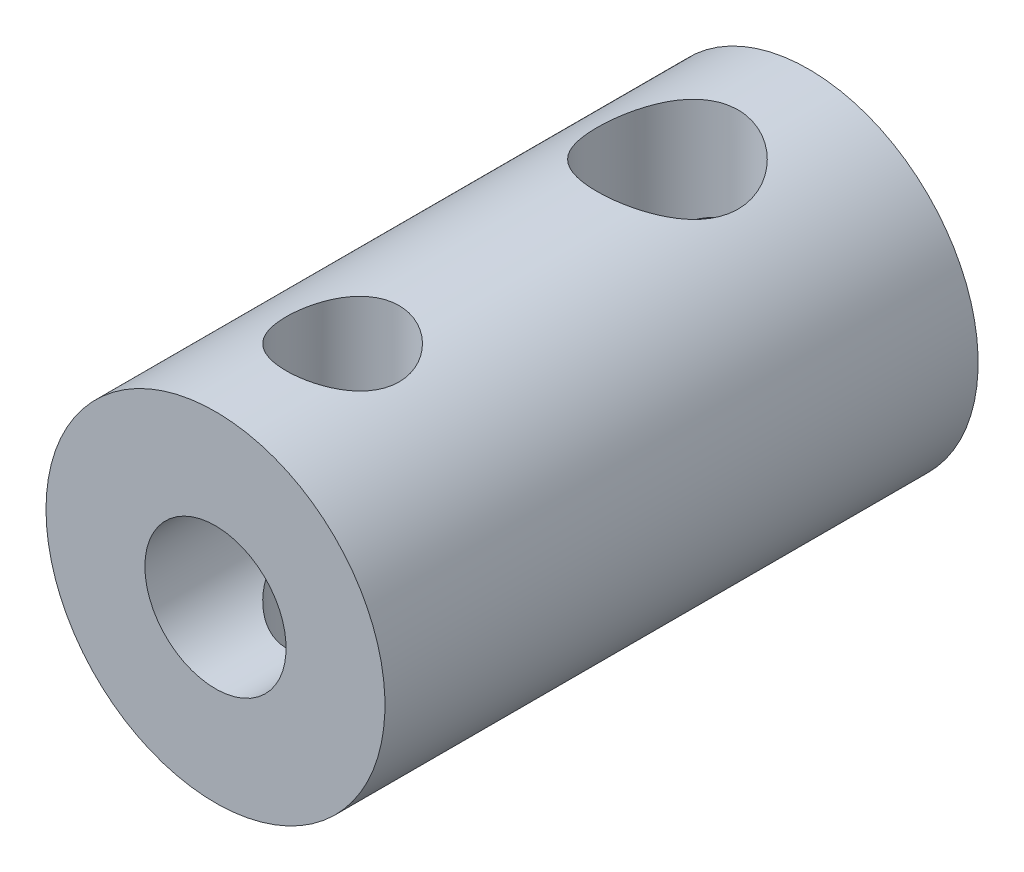
from build123d import *

# Parameters (mm, degrees)
SKETCH_1_W                = 6
SKETCH_1_H                = 21
HOLE_WIZARD_5_0_5_1_D     = 5
HOLE_WIZARD_5_0_5_2_D     = 5
HOLE_WIZARD_5_0_5_2_DEPTH = 18
SKETCH_5_W                = 2
SKETCH_5_H                = 4.5
HOLE_WIZARD_4_0_4_2_D     = 4


with BuildPart() as part:
    # 草图1 → 旋转1 (revolve)
    with BuildSketch(Plane.XZ.offset(40), mode=Mode.PRIVATE) as revolve_1_sk:
        with Locations((12, -20.5)):
            Rectangle(SKETCH_1_W, SKETCH_1_H)
    revolve(revolve_1_sk.sketch.rotate(Axis((9, -40, -10), (0, 0, -1)), 180), axis=Axis((9, -40, -10), (0, 0, -1)))

    # Ø5.0 (5) 直径孔1 (through all)
    with Locations(Plane(origin=(0, 0, -31), x_dir=(-1, 0, 0), z_dir=(0, 0, -1))):
        with Locations((-9, -40)):
            Hole(HOLE_WIZARD_5_0_5_1_D / 2)

    # Ø5.0 (5) 直径孔2
    with Locations(Plane(origin=(9, -46, -26), x_dir=(-1, 0, 0), z_dir=(0, -1, 0))):
        with Locations((0, 0)):
            Hole(HOLE_WIZARD_5_0_5_2_D / 2, depth=HOLE_WIZARD_5_0_5_2_DEPTH)

    # 草图5 → Ø4.0 (4) 直径孔1 (revolve, cut)
    with BuildSketch(Plane(origin=(9, -41.5, -14.5), x_dir=(0, 0, 1), z_dir=(1, 0, 0))):
        with Locations((1, 2.25)):
            Rectangle(SKETCH_5_W, SKETCH_5_H)
    revolve(axis=Axis((9, -35.15, -14.5), (0, -1, 0)), mode=Mode.SUBTRACT)

    # Ø4.0 (4) 直径孔2 (through all)
    with Locations(Plane(origin=(0, -38.5, 0), x_dir=(-1, 0, 0), z_dir=(0, -1, 0))):
        with Locations((-9, 14.5)):
            Hole(HOLE_WIZARD_4_0_4_2_D / 2)


solid = part.part
